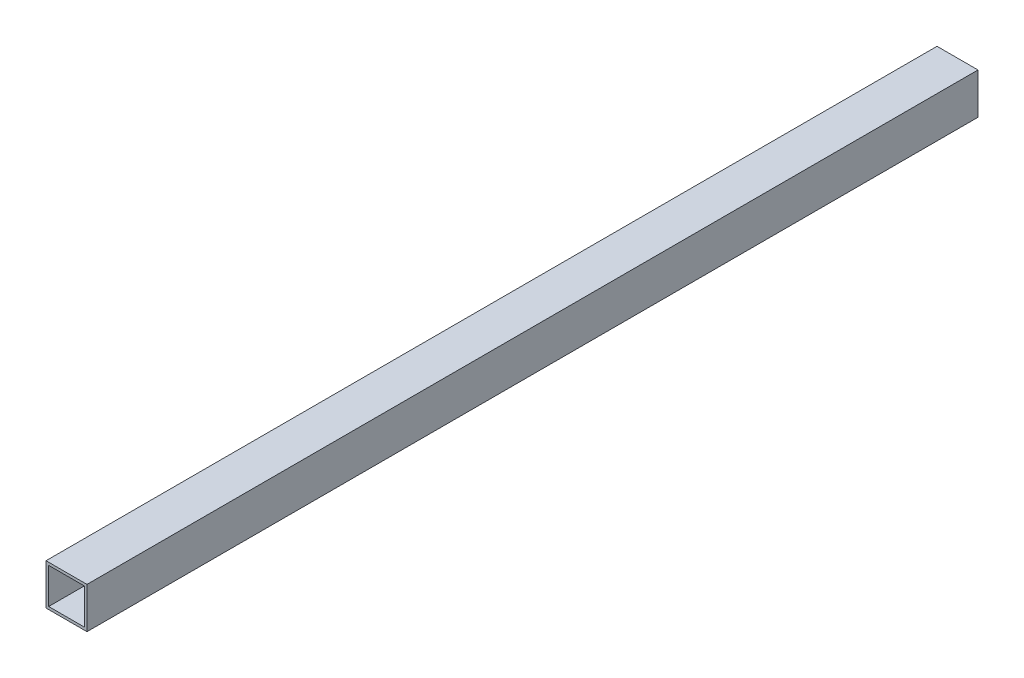
from build123d import *

# Parameters (mm, degrees)
SKETCH_1_W      = 46
SKETCH_1_H      = 46
SKETCH_1_W_2    = 40
SKETCH_1_H_2    = 40
EXTRUDE_2_DEPTH = 1000


with BuildPart() as part:
    # 草图1 → 凸台-拉伸2 (new body)
    with BuildSketch(Plane.XY):
        Rectangle(SKETCH_1_W, SKETCH_1_H)
        Rectangle(SKETCH_1_W_2, SKETCH_1_H_2, mode=Mode.SUBTRACT)
    extrude(amount=EXTRUDE_2_DEPTH)


solid = part.part
